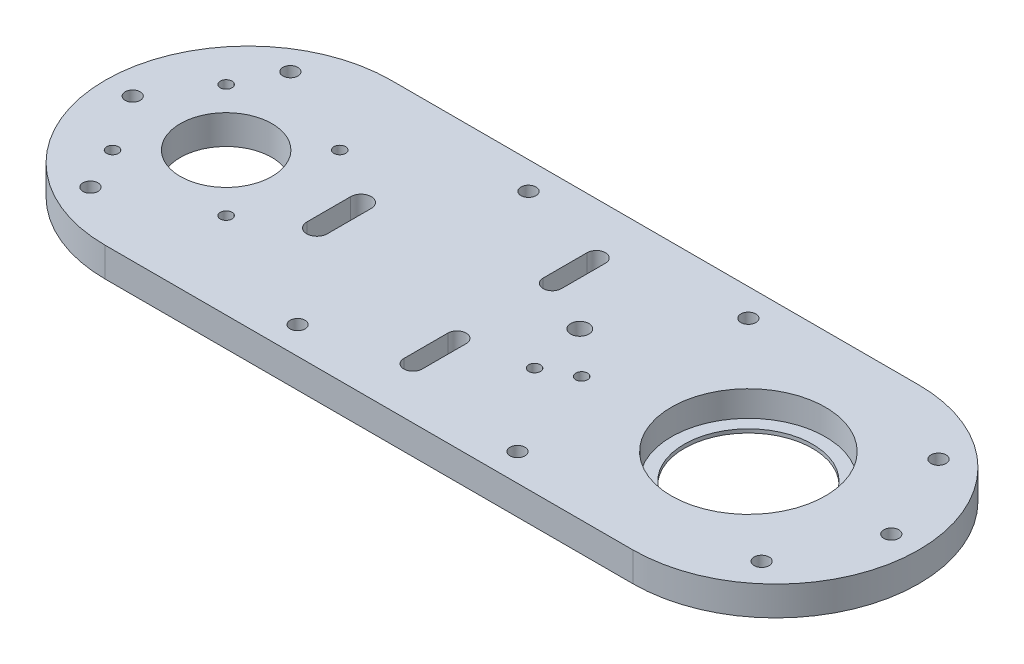
from build123d import *

# Parameters (mm, degrees)
BOSS_EXTRUDE1_DEPTH                                 = 8
SKETCH2_R                                           = 17.5
SKETCH2_R_2                                         = 12.5
CUT_EXTRUDE1_DEPTH                                  = 188.280538231
SKETCH3_R                                           = 1.6
CUT_EXTRUDE2_DEPTH                                  = 188.280538231
SKETCH4_R                                           = 2.05
CUT_EXTRUDE3_DEPTH                                  = 188.280538231
CUT_EXTRUDE4_DEPTH                                  = 188.280538231
SKETCH6_R                                           = 1.6
SKETCH6_R_2                                         = 2.5
CUT_EXTRUDE5_DEPTH                                  = 188.280538231
SKETCH7_R                                           = 21
CUT_EXTRUDE6_DEPTH                                  = 7
CSK_FOR_M4_COUNTERSUNK_FLAT_HEAD_SCREW1_D           = 4.1
CSK_FOR_M4_COUNTERSUNK_FLAT_HEAD_SCREW1_CSINK_D     = 9.1
CSK_FOR_M4_COUNTERSUNK_FLAT_HEAD_SCREW1_CSINK_ANGLE = 90
CUT_EXTRUDE7_DEPTH                                  = 188.280538231


with BuildPart() as part:
    # Sketch1 → Boss-Extrude1 (new body)
    with BuildSketch(Plane(origin=(0, 0, 0), x_dir=(1, 0, 0), z_dir=(0, 1, 0))):
        with BuildLine():
            Line((-144, 39), (0, 39))
            ThreePointArc((0, 39), (39, 0), (0, -39))
            Line((0, -39), (-144, -39))
            ThreePointArc((-144, -39), (-183, 0), (-144, 39))
        make_face()
    extrude(amount=BOSS_EXTRUDE1_DEPTH)

    # Sketch2 → Cut-Extrude1 (cut, through all)
    with BuildSketch(Plane(origin=(0, 8, 0), x_dir=(1, 0, 0), z_dir=(0, 1, 0))):
        with Locations((-7.5, 0)):
            Circle(SKETCH2_R)
        with Locations((-150, 0)):
            Circle(SKETCH2_R_2)
    extrude(amount=-CUT_EXTRUDE1_DEPTH, mode=Mode.SUBTRACT)

    # Sketch3 → Cut-Extrude2 (cut, through all)
    with BuildSketch(Plane(origin=(0, 8, 0), x_dir=(1, 0, 0), z_dir=(0, 1, 0))):
        with Locations((-165.5, 15.5)):
            Circle(SKETCH3_R)
        with Locations((-134.5, 15.5)):
            Circle(SKETCH3_R)
        with Locations((-134.5, -15.5)):
            Circle(SKETCH3_R)
        with Locations((-165.5, -15.5)):
            Circle(SKETCH3_R)
    extrude(amount=-CUT_EXTRUDE2_DEPTH, mode=Mode.SUBTRACT)

    # Sketch4 → Cut-Extrude3 (cut, through all)
    with BuildSketch(Plane(origin=(0, 8, 0), x_dir=(1, 0, 0), z_dir=(0, 1, 0))):
        with Locations((-159.75, 27.279800219)):
            Circle(SKETCH4_R)
        with Locations((-175.5, 0)):
            Circle(SKETCH4_R)
        with Locations((-159.75, -27.279800219)):
            Circle(SKETCH4_R)
        with Locations((20.247809705, 24.130399958)):
            Circle(SKETCH4_R)
        with Locations((31.5, 0)):
            Circle(SKETCH4_R)
        with Locations((20.247809705, -24.130399958)):
            Circle(SKETCH4_R)
        with Locations((-99, 31.5)):
            Circle(SKETCH4_R)
        with Locations((-39, 31.5)):
            Circle(SKETCH4_R)
        with Locations((-39, -31.5)):
            Circle(SKETCH4_R)
        with Locations((-99, -31.5)):
            Circle(SKETCH4_R)
    extrude(amount=-CUT_EXTRUDE3_DEPTH, mode=Mode.SUBTRACT)

    # Sketch5 → Cut-Extrude4 (cut, through all)
    with BuildSketch(Plane(origin=(0, 8, 0), x_dir=(1, 0, 0), z_dir=(0, 1, 0))):
        with BuildLine():
            Line((-76.5, -25), (-76.5, -13))
            ThreePointArc((-76.5, -13), (-74, -10.5), (-71.5, -13))
            Line((-71.5, -13), (-71.5, -25))
            ThreePointArc((-71.5, -25), (-74, -27.5), (-76.5, -25))
        make_face()
        with BuildLine():
            Line((-71.5, 25), (-71.5, 13))
            ThreePointArc((-71.5, 13), (-74, 10.5), (-76.5, 13))
            Line((-76.5, 13), (-76.5, 25))
            ThreePointArc((-76.5, 25), (-74, 27.5), (-71.5, 25))
        make_face()
    extrude(amount=-CUT_EXTRUDE4_DEPTH, mode=Mode.SUBTRACT)

    # Sketch6 → Cut-Extrude5 (cut, through all)
    with BuildSketch(Plane(origin=(0, 8, 0), x_dir=(1, 0, 0), z_dir=(0, 1, 0))):
        with Locations((-48, -5)):
            Circle(SKETCH6_R)
        with Locations((-56.388002132, -9.459979846)):
            Circle(SKETCH6_R)
        with Locations((-59.5, 6)):
            Circle(SKETCH6_R_2)
    extrude(amount=-CUT_EXTRUDE5_DEPTH, mode=Mode.SUBTRACT)

    # Sketch7 → Cut-Extrude6 (cut)
    with BuildSketch(Plane(origin=(0, 8, 0), x_dir=(1, 0, 0), z_dir=(0, 1, 0))):
        with Locations((-7.5, 0)):
            Circle(SKETCH7_R)
    extrude(amount=-CUT_EXTRUDE6_DEPTH, mode=Mode.SUBTRACT)

    # CSK for M4 Countersunk Flat Head Screw1 (through all)
    with Locations(Plane(origin=(-159.75, 0, 27.279800219), x_dir=(0, 0, -1), z_dir=(0, -1, 0))):
        with Locations((0, 0), (27.279800219, -15.75), (54.559600438, 0), (-4.220199781, 60.75), (58.779800219, 60.75), (-4.220199781, 120.75), (58.779800219, 120.75), (3.149400261, 179.997809705), (27.279800219, 191.25), (51.410200177, 179.997809705)):
            CounterSinkHole(CSK_FOR_M4_COUNTERSUNK_FLAT_HEAD_SCREW1_D / 2, CSK_FOR_M4_COUNTERSUNK_FLAT_HEAD_SCREW1_CSINK_D / 2, counter_sink_angle=CSK_FOR_M4_COUNTERSUNK_FLAT_HEAD_SCREW1_CSINK_ANGLE)

    # Sketch9 → Cut-Extrude7 (cut, through all)
    with BuildSketch(Plane(origin=(0, 8, 0), x_dir=(1, 0, 0), z_dir=(0, 1, 0))):
        with BuildLine():
            Line((-122, -6), (-122, 6))
            ThreePointArc((-122, 6), (-119.2, 8.8), (-116.4, 6))
            Line((-116.4, 6), (-116.4, -6))
            ThreePointArc((-116.4, -6), (-119.2, -8.8), (-122, -6))
        make_face()
    extrude(amount=-CUT_EXTRUDE7_DEPTH, mode=Mode.SUBTRACT)


solid = part.part
